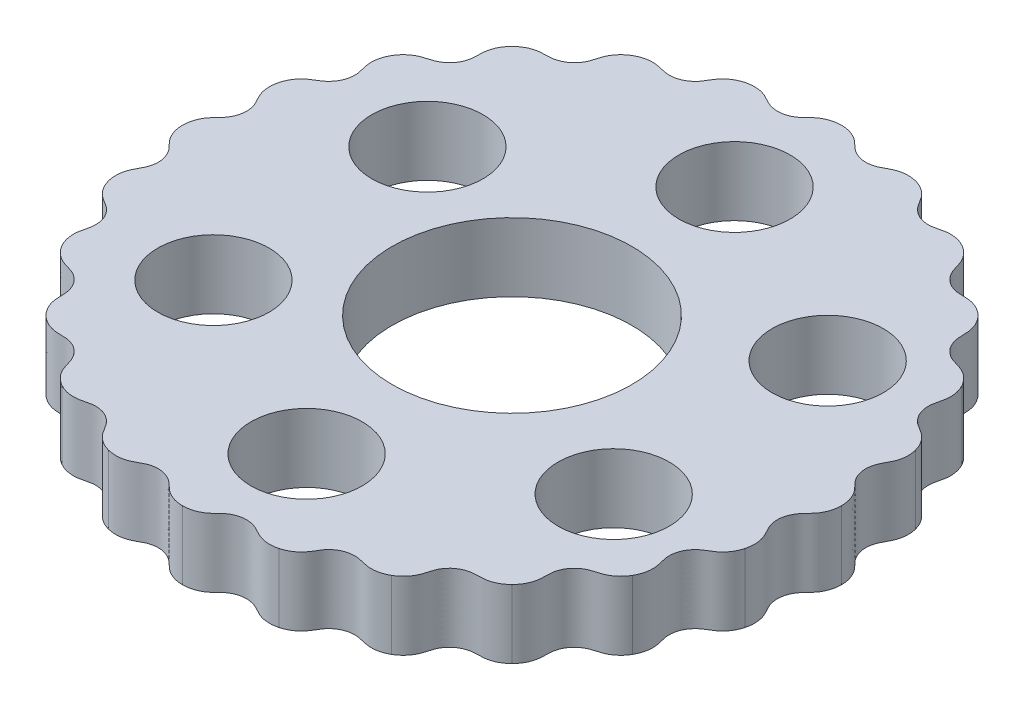
from build123d import *

# Parameters (mm, degrees)
SKETCH1_R           = 14
SKETCH1_R_2         = 6.5
BOSS_EXTRUDE1_DEPTH = 8


with BuildPart() as part:
    # Sketch1 → Boss-Extrude1 (new body)
    with BuildSketch(Plane(origin=(0, 0, 0), x_dir=(1, 0, 0), z_dir=(0, 1, 0))):
        with BuildLine():
            add(Edge.make_bspline(
                [(-38.188097082, 9.9647088), (-38.113372009, 10.244100974), (-37.951839108, 10.654037682), (-37.652977987, 11.14456219), (-37.390260931, 11.479949616), (-37.145465578, 11.725596787), (-36.927714992, 11.908277882), (-36.752948947, 12.0384598), (-36.590559186, 12.146195792), (-36.458882173, 12.226744009), (-36.305001509, 12.317396194), (-36.107721818, 12.43804004), (-35.856239089, 12.594685167), (-35.413957853, 12.936912027), (-35.008192839, 13.424260923), (-34.730315468, 13.922699482), (-34.557012484, 14.436902449), (-34.457602125, 15.223415448), (-34.576890778, 15.867285655), (-34.632823051, 16.071325063), (-34.673334751, 16.238891625), (-34.711262719, 16.392459936), (-34.752702236, 16.572074341), (-34.794830164, 16.780749484), (-34.825838307, 16.988053197), (-34.8500137, 17.262666694), (-34.849186563, 17.61539272), (-34.797869935, 18.037592245), (-34.662664385, 18.594763053), (-34.486664191, 18.999578144), (-34.341886986, 19.250157358)],
                knots=[-8.4146e-05, -8.4146e-05, -8.4146e-05, -8.4146e-05, 0.124936892, 0.187447412, 0.249957931, 0.31246845, 0.34372371, 0.37497897, 0.406234229, 0.421861859, 0.437489489, 0.453117119, 0.468744749, 0.484372378, 0.492186193, 0.500000008, 0.507813823, 0.515627638, 0.531255268, 0.546882898, 0.562510528, 0.578138157, 0.593765787, 0.625021047, 0.656276307, 0.687531566, 0.750042086, 0.812552605, 0.875063124, 1.000084163, 1.000084163, 1.000084163, 1.000084163], degree=3))
            add(Edge.make_bspline(
                [(-34.341886986, 19.250157358), (-34.197396092, 19.500689201), (-33.935267864, 19.854849864), (-33.519633104, 20.251309204), (-33.179063261, 20.507272404), (-32.879030942, 20.681191651), (-32.62141868, 20.801290039), (-32.418914084, 20.881803336), (-32.234173493, 20.943838749), (-32.086135853, 20.987561834), (-31.914036033, 21.035297874), (-31.69225356, 21.100771139), (-31.408797155, 21.186990194), (-30.893011458, 21.403085149), (-30.374937375, 21.768808321), (-29.977523054, 22.178343042), (-29.677039705, 22.630170855), (-29.377452129, 23.364154779), (-29.326030247, 24.016959816), (-29.32724739, 24.228523087), (-29.323009269, 24.400865157), (-29.31989847, 24.559017234), (-29.31343834, 24.743236764), (-29.300121693, 24.955704984), (-29.27641911, 25.163970492), (-29.228695543, 25.435483813), (-29.136604377, 25.775976912), (-28.977763043, 26.170508616), (-28.702958094, 26.673700518), (-28.428181106, 27.019169667), (-28.223482392, 27.223739503)],
                knots=[-8.4146e-05, -8.4146e-05, -8.4146e-05, -8.4146e-05, 0.124936892, 0.187447412, 0.249957931, 0.31246845, 0.34372371, 0.37497897, 0.406234229, 0.421861859, 0.437489489, 0.453117119, 0.468744749, 0.484372378, 0.492186193, 0.500000008, 0.507813823, 0.515627638, 0.531255268, 0.546882898, 0.562510528, 0.578138157, 0.593765787, 0.625021047, 0.656276307, 0.687531566, 0.750042086, 0.812552605, 0.875063124, 1.000084163, 1.000084163, 1.000084163, 1.000084163], degree=3))
            add(Edge.make_bspline(
                [(-28.223482392, 27.223739503), (-28.019072493, 27.428337686), (-27.674212543, 27.702586839), (-27.170128967, 27.977962964), (-26.774915608, 28.137058467), (-26.440093029, 28.227397481), (-26.160174942, 28.276728657), (-25.943732148, 28.302086483), (-25.749230494, 28.314193708), (-25.594920747, 28.318112004), (-25.41633009, 28.319678767), (-25.185158943, 28.325519557), (-24.889045948, 28.335436852), (-24.334905732, 28.410673388), (-23.739828474, 28.629847406), (-23.249960332, 28.922569175), (-22.842774062, 29.281230515), (-22.363425666, 29.912665573), (-22.144797566, 30.529917856), (-22.091216632, 30.734587303), (-22.042517512, 30.899960052), (-21.998579941, 31.051918094), (-21.944660412, 31.228188491), (-21.876806697, 31.42997043), (-21.800008679, 31.625004783), (-21.683638435, 31.874914744), (-21.506559101, 32.179970874), (-21.251017835, 32.519948074), (-20.85534099, 32.934869374), (-20.500512806, 33.197449429), (-20.249842461, 33.342068792)],
                knots=[-8.4146e-05, -8.4146e-05, -8.4146e-05, -8.4146e-05, 0.124936892, 0.187447412, 0.249957931, 0.31246845, 0.34372371, 0.37497897, 0.406234229, 0.421861859, 0.437489489, 0.453117119, 0.468744749, 0.484372378, 0.492186193, 0.500000008, 0.507813823, 0.515627638, 0.531255268, 0.546882898, 0.562510528, 0.578138157, 0.593765787, 0.625021047, 0.656276307, 0.687531566, 0.750042086, 0.812552605, 0.875063124, 1.000084163, 1.000084163, 1.000084163, 1.000084163], degree=3))
            add(Edge.make_bspline(
                [(-20.249842461, 33.342068792), (-19.999443754, 33.486790286), (-19.595353719, 33.662438303), (-19.037173788, 33.797964783), (-18.614250052, 33.849350495), (-18.267454818, 33.849952821), (-17.984306861, 33.825154945), (-17.768676088, 33.793629208), (-17.577668336, 33.754983156), (-17.427602437, 33.718829639), (-17.254691601, 33.674120352), (-17.029885713, 33.619930626), (-16.741295738, 33.552870315), (-16.186564743, 33.482121187), (-15.555037841, 33.539809704), (-15.006099582, 33.695770015), (-14.519959463, 33.936822705), (-13.893517049, 34.422677641), (-13.522581874, 34.962312446), (-13.417854315, 35.146140185), (-13.328012961, 35.293273735), (-13.24624289, 35.428682052), (-13.148538489, 35.584990779), (-13.030771824, 35.762335332), (-12.906112031, 35.930847261), (-12.729025549, 36.142122911), (-12.479025711, 36.390953001), (-12.144199228, 36.653206813), (-11.65461521, 36.951581309), (-11.243916784, 37.113377874), (-10.964357579, 37.188191192)],
                knots=[-8.4146e-05, -8.4146e-05, -8.4146e-05, -8.4146e-05, 0.124936892, 0.187447412, 0.249957931, 0.31246845, 0.34372371, 0.37497897, 0.406234229, 0.421861859, 0.437489489, 0.453117119, 0.468744749, 0.484372378, 0.492186193, 0.500000008, 0.507813823, 0.515627638, 0.531255268, 0.546882898, 0.562510528, 0.578138157, 0.593765787, 0.625021047, 0.656276307, 0.687531566, 0.750042086, 0.812552605, 0.875063124, 1.000084163, 1.000084163, 1.000084163, 1.000084163], degree=3))
            add(Edge.make_bspline(
                [(-10.964357579, 37.188191192), (-10.685034322, 37.263173466), (-10.249252269, 37.328250225), (-9.675015023, 37.314691156), (-9.253202464, 37.254865224), (-8.918068097, 37.165689816), (-8.650986335, 37.068452823), (-8.450862464, 36.982191949), (-8.276365478, 36.895426285), (-8.140770169, 36.821664756), (-7.985322742, 36.733726284), (-7.782202261, 36.623198983), (-7.520802237, 36.483731115), (-7.003284465, 36.271817759), (-6.378345433, 36.164089397), (-5.807746293, 36.172659814), (-5.275781969, 36.279676511), (-4.544936552, 36.586841114), (-4.046972922, 37.012083221), (-3.898235749, 37.162541695), (-3.773374699, 37.281409137), (-3.659344625, 37.391039876), (-3.524513745, 37.516734753), (-3.364859734, 37.657556181), (-3.200833523, 37.788061877), (-2.975098956, 37.946305129), (-2.669215688, 38.121951821), (-2.27792186, 38.28861008), (-1.727795011, 38.450104043), (-1.289214762, 38.500090949), (-0.999818195, 38.499999819)],
                knots=[-8.4146e-05, -8.4146e-05, -8.4146e-05, -8.4146e-05, 0.124936892, 0.187447412, 0.249957931, 0.31246845, 0.34372371, 0.37497897, 0.406234229, 0.421861859, 0.437489489, 0.453117119, 0.468744749, 0.484372378, 0.492186193, 0.500000008, 0.507813823, 0.515627638, 0.531255268, 0.546882898, 0.562510528, 0.578138157, 0.593765787, 0.625021047, 0.656276307, 0.687531566, 0.750042086, 0.812552605, 0.875063124, 1.000084163, 1.000084163, 1.000084163, 1.000084163], degree=3))
            add(Edge.make_bspline(
                [(-0.999818195, 38.499999819), (-0.710605806, 38.500132956), (-0.272829562, 38.450203583), (0.278331679, 38.288482992), (0.670287233, 38.121522456), (0.970921879, 37.948646469), (1.203736266, 37.7855969), (1.374715124, 37.650479424), (1.520809663, 37.521507086), (1.632693786, 37.415164271), (1.760084318, 37.289989475), (1.927677066, 37.130656852), (2.14407316, 36.928285931), (2.58910973, 36.589649892), (3.164872328, 36.323846162), (3.718246961, 36.184442624), (4.259782999, 36.150130318), (5.045225512, 36.257671828), (5.636282199, 36.53954169), (5.818892795, 36.646377402), (5.970264465, 36.728878117), (6.108783582, 36.805260125), (6.271552439, 36.891775253), (6.462213639, 36.986476808), (6.654428151, 37.070082523), (6.913427368, 37.164509362), (7.254348625, 37.255002623), (7.67544377, 37.314707844), (8.248623215, 37.328315728), (8.685196768, 37.263086451), (8.9647088, 37.188097082)],
                knots=[-8.4146e-05, -8.4146e-05, -8.4146e-05, -8.4146e-05, 0.124936892, 0.187447412, 0.249957931, 0.31246845, 0.34372371, 0.37497897, 0.406234229, 0.421861859, 0.437489489, 0.453117119, 0.468744749, 0.484372378, 0.492186193, 0.500000008, 0.507813823, 0.515627638, 0.531255268, 0.546882898, 0.562510528, 0.578138157, 0.593765787, 0.625021047, 0.656276307, 0.687531566, 0.750042086, 0.812552605, 0.875063124, 1.000084163, 1.000084163, 1.000084163, 1.000084163], degree=3))
            add(Edge.make_bspline(
                [(8.9647088, 37.188097082), (9.244100974, 37.113372009), (9.654037682, 36.951839108), (10.14456219, 36.652977987), (10.479949616, 36.390260931), (10.725596787, 36.145465578), (10.908277882, 35.927714992), (11.0384598, 35.752948947), (11.146195792, 35.590559186), (11.226744009, 35.458882173), (11.317396194, 35.305001509), (11.43804004, 35.107721818), (11.594685167, 34.856239089), (11.936912027, 34.413957853), (12.424260923, 34.008192839), (12.922699482, 33.730315468), (13.436902449, 33.557012484), (14.223415448, 33.457602125), (14.867285655, 33.576890778), (15.071325063, 33.632823051), (15.238891625, 33.673334751), (15.392459936, 33.711262719), (15.572074341, 33.752702236), (15.780749484, 33.794830164), (15.988053197, 33.825838307), (16.262666694, 33.8500137), (16.61539272, 33.849186563), (17.037592245, 33.797869935), (17.594763053, 33.662664385), (17.999578144, 33.486664191), (18.250157358, 33.341886986)],
                knots=[-8.4146e-05, -8.4146e-05, -8.4146e-05, -8.4146e-05, 0.124936892, 0.187447412, 0.249957931, 0.31246845, 0.34372371, 0.37497897, 0.406234229, 0.421861859, 0.437489489, 0.453117119, 0.468744749, 0.484372378, 0.492186193, 0.500000008, 0.507813823, 0.515627638, 0.531255268, 0.546882898, 0.562510528, 0.578138157, 0.593765787, 0.625021047, 0.656276307, 0.687531566, 0.750042086, 0.812552605, 0.875063124, 1.000084163, 1.000084163, 1.000084163, 1.000084163], degree=3))
            add(Edge.make_bspline(
                [(18.250157358, 33.341886986), (18.500689201, 33.197396092), (18.854849864, 32.935267864), (19.251309204, 32.519633104), (19.507272404, 32.179063261), (19.681191651, 31.879030942), (19.801290039, 31.62141868), (19.881803336, 31.418914084), (19.943838749, 31.234173493), (19.987561834, 31.086135853), (20.035297874, 30.914036033), (20.100771139, 30.69225356), (20.186990194, 30.408797155), (20.403085149, 29.893011458), (20.768808321, 29.374937375), (21.178343042, 28.977523054), (21.630170855, 28.677039705), (22.364154779, 28.377452129), (23.016959816, 28.326030247), (23.228523087, 28.32724739), (23.400865157, 28.323009269), (23.559017234, 28.31989847), (23.743236764, 28.31343834), (23.955704984, 28.300121693), (24.163970492, 28.27641911), (24.435483813, 28.228695543), (24.775976912, 28.136604377), (25.170508616, 27.977763043), (25.673700518, 27.702958094), (26.019169667, 27.428181106), (26.223739503, 27.223482392)],
                knots=[-8.4146e-05, -8.4146e-05, -8.4146e-05, -8.4146e-05, 0.124936892, 0.187447412, 0.249957931, 0.31246845, 0.34372371, 0.37497897, 0.406234229, 0.421861859, 0.437489489, 0.453117119, 0.468744749, 0.484372378, 0.492186193, 0.500000008, 0.507813823, 0.515627638, 0.531255268, 0.546882898, 0.562510528, 0.578138157, 0.593765787, 0.625021047, 0.656276307, 0.687531566, 0.750042086, 0.812552605, 0.875063124, 1.000084163, 1.000084163, 1.000084163, 1.000084163], degree=3))
            add(Edge.make_bspline(
                [(26.223739503, 27.223482392), (26.428337686, 27.019072493), (26.702586839, 26.674212543), (26.977962964, 26.170128967), (27.137058467, 25.774915608), (27.227397481, 25.440093029), (27.276728657, 25.160174942), (27.302086483, 24.943732148), (27.314193708, 24.749230494), (27.318112004, 24.594920747), (27.319678767, 24.41633009), (27.325519557, 24.185158943), (27.335436852, 23.889045948), (27.410673388, 23.334905732), (27.629847406, 22.739828474), (27.922569175, 22.249960332), (28.281230515, 21.842774062), (28.912665573, 21.363425666), (29.529917856, 21.144797566), (29.734587303, 21.091216632), (29.899960052, 21.042517512), (30.051918094, 20.998579941), (30.228188491, 20.944660412), (30.42997043, 20.876806697), (30.625004783, 20.800008679), (30.874914744, 20.683638435), (31.179970874, 20.506559101), (31.519948074, 20.251017835), (31.934869374, 19.85534099), (32.197449429, 19.500512806), (32.342068792, 19.249842461)],
                knots=[-8.4146e-05, -8.4146e-05, -8.4146e-05, -8.4146e-05, 0.124936892, 0.187447412, 0.249957931, 0.31246845, 0.34372371, 0.37497897, 0.406234229, 0.421861859, 0.437489489, 0.453117119, 0.468744749, 0.484372378, 0.492186193, 0.500000008, 0.507813823, 0.515627638, 0.531255268, 0.546882898, 0.562510528, 0.578138157, 0.593765787, 0.625021047, 0.656276307, 0.687531566, 0.750042086, 0.812552605, 0.875063124, 1.000084163, 1.000084163, 1.000084163, 1.000084163], degree=3))
            add(Edge.make_bspline(
                [(32.342068792, 19.249842461), (32.486790286, 18.999443754), (32.662438303, 18.595353719), (32.797964783, 18.037173788), (32.849350495, 17.614250052), (32.849952821, 17.267454818), (32.825154945, 16.984306861), (32.793629208, 16.768676088), (32.754983156, 16.577668336), (32.718829639, 16.427602437), (32.674120352, 16.254691601), (32.619930626, 16.029885713), (32.552870315, 15.741295738), (32.482121187, 15.186564743), (32.539809704, 14.555037841), (32.695770015, 14.006099582), (32.936822705, 13.519959463), (33.422677641, 12.893517049), (33.962312446, 12.522581874), (34.146140185, 12.417854315), (34.293273735, 12.328012961), (34.428682052, 12.24624289), (34.584990779, 12.148538489), (34.762335332, 12.030771824), (34.930847261, 11.906112031), (35.142122911, 11.729025549), (35.390953001, 11.479025711), (35.653206813, 11.144199228), (35.951581309, 10.65461521), (36.113377874, 10.243916784), (36.188191192, 9.964357579)],
                knots=[-8.4146e-05, -8.4146e-05, -8.4146e-05, -8.4146e-05, 0.124936892, 0.187447412, 0.249957931, 0.31246845, 0.34372371, 0.37497897, 0.406234229, 0.421861859, 0.437489489, 0.453117119, 0.468744749, 0.484372378, 0.492186193, 0.500000008, 0.507813823, 0.515627638, 0.531255268, 0.546882898, 0.562510528, 0.578138157, 0.593765787, 0.625021047, 0.656276307, 0.687531566, 0.750042086, 0.812552605, 0.875063124, 1.000084163, 1.000084163, 1.000084163, 1.000084163], degree=3))
            add(Edge.make_bspline(
                [(36.188191192, 9.964357579), (36.263173466, 9.685034322), (36.328250225, 9.249252269), (36.314691156, 8.675015023), (36.254865224, 8.253202464), (36.165689816, 7.918068097), (36.068452823, 7.650986335), (35.982191949, 7.450862464), (35.895426285, 7.276365478), (35.821664756, 7.140770169), (35.733726284, 6.985322742), (35.623198983, 6.782202261), (35.483731115, 6.520802237), (35.271817759, 6.003284465), (35.164089397, 5.378345433), (35.172659814, 4.807746293), (35.279676511, 4.275781969), (35.586841114, 3.544936552), (36.012083221, 3.046972922), (36.162541695, 2.898235749), (36.281409137, 2.773374699), (36.391039876, 2.659344625), (36.516734753, 2.524513745), (36.657556181, 2.364859734), (36.788061877, 2.200833523), (36.946305129, 1.975098956), (37.121951821, 1.669215688), (37.28861008, 1.27792186), (37.450104043, 0.727795011), (37.500090949, 0.289214762), (37.499999819, -0.000181805)],
                knots=[-8.4146e-05, -8.4146e-05, -8.4146e-05, -8.4146e-05, 0.124936892, 0.187447412, 0.249957931, 0.31246845, 0.34372371, 0.37497897, 0.406234229, 0.421861859, 0.437489489, 0.453117119, 0.468744749, 0.484372378, 0.492186193, 0.500000008, 0.507813823, 0.515627638, 0.531255268, 0.546882898, 0.562510528, 0.578138157, 0.593765787, 0.625021047, 0.656276307, 0.687531566, 0.750042086, 0.812552605, 0.875063124, 1.000084163, 1.000084163, 1.000084163, 1.000084163], degree=3))
            add(Edge.make_bspline(
                [(37.499999819, -0.000181805), (37.500132956, -0.289394194), (37.450203583, -0.727170438), (37.288482992, -1.278331679), (37.121522456, -1.670287233), (36.948646469, -1.970921879), (36.7855969, -2.203736266), (36.650479424, -2.374715124), (36.521507086, -2.520809663), (36.415164271, -2.632693786), (36.289989475, -2.760084318), (36.130656852, -2.927677066), (35.928285931, -3.14407316), (35.589649892, -3.58910973), (35.323846162, -4.164872328), (35.184442624, -4.718246961), (35.150130318, -5.259782999), (35.257671828, -6.045225512), (35.53954169, -6.636282199), (35.646377402, -6.818892795), (35.728878117, -6.970264465), (35.805260125, -7.108783582), (35.891775253, -7.271552439), (35.986476808, -7.462213639), (36.070082523, -7.654428151), (36.164509362, -7.913427368), (36.255002623, -8.254348625), (36.314707844, -8.67544377), (36.328315728, -9.248623215), (36.263086451, -9.685196768), (36.188097082, -9.9647088)],
                knots=[-8.4146e-05, -8.4146e-05, -8.4146e-05, -8.4146e-05, 0.124936892, 0.187447412, 0.249957931, 0.31246845, 0.34372371, 0.37497897, 0.406234229, 0.421861859, 0.437489489, 0.453117119, 0.468744749, 0.484372378, 0.492186193, 0.500000008, 0.507813823, 0.515627638, 0.531255268, 0.546882898, 0.562510528, 0.578138157, 0.593765787, 0.625021047, 0.656276307, 0.687531566, 0.750042086, 0.812552605, 0.875063124, 1.000084163, 1.000084163, 1.000084163, 1.000084163], degree=3))
            add(Edge.make_bspline(
                [(36.188097082, -9.9647088), (36.113372009, -10.244100974), (35.951839108, -10.654037682), (35.652977987, -11.14456219), (35.390260931, -11.479949616), (35.145465578, -11.725596787), (34.927714992, -11.908277882), (34.752948947, -12.0384598), (34.590559186, -12.146195792), (34.458882173, -12.226744009), (34.305001509, -12.317396194), (34.107721818, -12.43804004), (33.856239089, -12.594685167), (33.413957853, -12.936912027), (33.008192839, -13.424260923), (32.730315468, -13.922699482), (32.557012484, -14.436902449), (32.457602125, -15.223415448), (32.576890778, -15.867285655), (32.632823051, -16.071325063), (32.673334751, -16.238891625), (32.711262719, -16.392459936), (32.752702236, -16.572074341), (32.794830164, -16.780749484), (32.825838307, -16.988053197), (32.8500137, -17.262666694), (32.849186563, -17.61539272), (32.797869935, -18.037592245), (32.662664385, -18.594763053), (32.486664191, -18.999578144), (32.341886986, -19.250157358)],
                knots=[-8.4146e-05, -8.4146e-05, -8.4146e-05, -8.4146e-05, 0.124936892, 0.187447412, 0.249957931, 0.31246845, 0.34372371, 0.37497897, 0.406234229, 0.421861859, 0.437489489, 0.453117119, 0.468744749, 0.484372378, 0.492186193, 0.500000008, 0.507813823, 0.515627638, 0.531255268, 0.546882898, 0.562510528, 0.578138157, 0.593765787, 0.625021047, 0.656276307, 0.687531566, 0.750042086, 0.812552605, 0.875063124, 1.000084163, 1.000084163, 1.000084163, 1.000084163], degree=3))
            add(Edge.make_bspline(
                [(32.341886986, -19.250157358), (32.197396092, -19.500689201), (31.935267864, -19.854849864), (31.519633104, -20.251309204), (31.179063261, -20.507272404), (30.879030942, -20.681191651), (30.62141868, -20.801290039), (30.418914084, -20.881803336), (30.234173493, -20.943838749), (30.086135853, -20.987561834), (29.914036033, -21.035297874), (29.69225356, -21.100771139), (29.408797155, -21.186990194), (28.893011458, -21.403085149), (28.374937375, -21.768808321), (27.977523054, -22.178343042), (27.677039705, -22.630170855), (27.377452129, -23.364154779), (27.326030247, -24.016959816), (27.32724739, -24.228523087), (27.323009269, -24.400865157), (27.31989847, -24.559017234), (27.31343834, -24.743236764), (27.300121693, -24.955704984), (27.27641911, -25.163970492), (27.228695543, -25.435483813), (27.136604377, -25.775976912), (26.977763043, -26.170508616), (26.702958094, -26.673700518), (26.428181106, -27.019169667), (26.223482392, -27.223739503)],
                knots=[-8.4146e-05, -8.4146e-05, -8.4146e-05, -8.4146e-05, 0.124936892, 0.187447412, 0.249957931, 0.31246845, 0.34372371, 0.37497897, 0.406234229, 0.421861859, 0.437489489, 0.453117119, 0.468744749, 0.484372378, 0.492186193, 0.500000008, 0.507813823, 0.515627638, 0.531255268, 0.546882898, 0.562510528, 0.578138157, 0.593765787, 0.625021047, 0.656276307, 0.687531566, 0.750042086, 0.812552605, 0.875063124, 1.000084163, 1.000084163, 1.000084163, 1.000084163], degree=3))
            add(Edge.make_bspline(
                [(26.223482392, -27.223739503), (26.019072493, -27.428337686), (25.674212543, -27.702586839), (25.170128967, -27.977962964), (24.774915608, -28.137058467), (24.440093029, -28.227397481), (24.160174942, -28.276728657), (23.943732148, -28.302086483), (23.749230494, -28.314193708), (23.594920747, -28.318112004), (23.41633009, -28.319678767), (23.185158943, -28.325519557), (22.889045948, -28.335436852), (22.334905732, -28.410673388), (21.739828474, -28.629847406), (21.249960332, -28.922569175), (20.842774062, -29.281230515), (20.363425666, -29.912665573), (20.144797566, -30.529917856), (20.091216632, -30.734587303), (20.042517512, -30.899960052), (19.998579941, -31.051918094), (19.944660412, -31.228188491), (19.876806697, -31.42997043), (19.800008679, -31.625004783), (19.683638435, -31.874914744), (19.506559101, -32.179970874), (19.251017835, -32.519948074), (18.85534099, -32.934869374), (18.500512806, -33.197449429), (18.249842461, -33.342068792)],
                knots=[-8.4146e-05, -8.4146e-05, -8.4146e-05, -8.4146e-05, 0.124936892, 0.187447412, 0.249957931, 0.31246845, 0.34372371, 0.37497897, 0.406234229, 0.421861859, 0.437489489, 0.453117119, 0.468744749, 0.484372378, 0.492186193, 0.500000008, 0.507813823, 0.515627638, 0.531255268, 0.546882898, 0.562510528, 0.578138157, 0.593765787, 0.625021047, 0.656276307, 0.687531566, 0.750042086, 0.812552605, 0.875063124, 1.000084163, 1.000084163, 1.000084163, 1.000084163], degree=3))
            add(Edge.make_bspline(
                [(18.249842461, -33.342068792), (17.999443754, -33.486790286), (17.595353719, -33.662438303), (17.037173788, -33.797964783), (16.614250052, -33.849350495), (16.267454818, -33.849952821), (15.984306861, -33.825154945), (15.768676088, -33.793629208), (15.577668336, -33.754983156), (15.427602437, -33.718829639), (15.254691601, -33.674120352), (15.029885713, -33.619930626), (14.741295738, -33.552870315), (14.186564743, -33.482121187), (13.555037841, -33.539809704), (13.006099582, -33.695770015), (12.519959463, -33.936822705), (11.893517049, -34.422677641), (11.522581874, -34.962312446), (11.417854315, -35.146140185), (11.328012961, -35.293273735), (11.24624289, -35.428682052), (11.148538489, -35.584990779), (11.030771824, -35.762335332), (10.906112031, -35.930847261), (10.729025549, -36.142122911), (10.479025711, -36.390953001), (10.144199228, -36.653206813), (9.65461521, -36.951581309), (9.243916784, -37.113377874), (8.964357579, -37.188191192)],
                knots=[-8.4146e-05, -8.4146e-05, -8.4146e-05, -8.4146e-05, 0.124936892, 0.187447412, 0.249957931, 0.31246845, 0.34372371, 0.37497897, 0.406234229, 0.421861859, 0.437489489, 0.453117119, 0.468744749, 0.484372378, 0.492186193, 0.500000008, 0.507813823, 0.515627638, 0.531255268, 0.546882898, 0.562510528, 0.578138157, 0.593765787, 0.625021047, 0.656276307, 0.687531566, 0.750042086, 0.812552605, 0.875063124, 1.000084163, 1.000084163, 1.000084163, 1.000084163], degree=3))
            add(Edge.make_bspline(
                [(8.964357579, -37.188191192), (8.685034322, -37.263173466), (8.249252269, -37.328250225), (7.675015023, -37.314691156), (7.253202464, -37.254865224), (6.918068097, -37.165689816), (6.650986335, -37.068452823), (6.450862464, -36.982191949), (6.276365478, -36.895426285), (6.140770169, -36.821664756), (5.985322742, -36.733726284), (5.782202261, -36.623198983), (5.520802237, -36.483731115), (5.003284465, -36.271817759), (4.378345433, -36.164089397), (3.807746293, -36.172659814), (3.275781969, -36.279676511), (2.544936552, -36.586841114), (2.046972922, -37.012083221), (1.898235749, -37.162541695), (1.773374699, -37.281409137), (1.659344625, -37.391039876), (1.524513745, -37.516734753), (1.364859734, -37.657556181), (1.200833523, -37.788061877), (0.975098956, -37.946305129), (0.669215688, -38.121951821), (0.27792186, -38.28861008), (-0.272204989, -38.450104043), (-0.710785238, -38.500090949), (-1.000181805, -38.499999819)],
                knots=[-8.4146e-05, -8.4146e-05, -8.4146e-05, -8.4146e-05, 0.124936892, 0.187447412, 0.249957931, 0.31246845, 0.34372371, 0.37497897, 0.406234229, 0.421861859, 0.437489489, 0.453117119, 0.468744749, 0.484372378, 0.492186193, 0.500000008, 0.507813823, 0.515627638, 0.531255268, 0.546882898, 0.562510528, 0.578138157, 0.593765787, 0.625021047, 0.656276307, 0.687531566, 0.750042086, 0.812552605, 0.875063124, 1.000084163, 1.000084163, 1.000084163, 1.000084163], degree=3))
            add(Edge.make_bspline(
                [(-1.000181805, -38.499999819), (-1.289394194, -38.500132956), (-1.727170438, -38.450203583), (-2.278331679, -38.288482992), (-2.670287233, -38.121522456), (-2.970921879, -37.948646469), (-3.203736266, -37.7855969), (-3.374715124, -37.650479424), (-3.520809663, -37.521507086), (-3.632693786, -37.415164271), (-3.760084318, -37.289989475), (-3.927677066, -37.130656852), (-4.14407316, -36.928285931), (-4.58910973, -36.589649892), (-5.164872328, -36.323846162), (-5.718246961, -36.184442624), (-6.259782999, -36.150130318), (-7.045225512, -36.257671828), (-7.636282199, -36.53954169), (-7.818892795, -36.646377402), (-7.970264465, -36.728878117), (-8.108783582, -36.805260125), (-8.271552439, -36.891775253), (-8.462213639, -36.986476808), (-8.654428151, -37.070082523), (-8.913427368, -37.164509362), (-9.254348625, -37.255002623), (-9.67544377, -37.314707844), (-10.248623215, -37.328315728), (-10.685196768, -37.263086451), (-10.9647088, -37.188097082)],
                knots=[-8.4146e-05, -8.4146e-05, -8.4146e-05, -8.4146e-05, 0.124936892, 0.187447412, 0.249957931, 0.31246845, 0.34372371, 0.37497897, 0.406234229, 0.421861859, 0.437489489, 0.453117119, 0.468744749, 0.484372378, 0.492186193, 0.500000008, 0.507813823, 0.515627638, 0.531255268, 0.546882898, 0.562510528, 0.578138157, 0.593765787, 0.625021047, 0.656276307, 0.687531566, 0.750042086, 0.812552605, 0.875063124, 1.000084163, 1.000084163, 1.000084163, 1.000084163], degree=3))
            add(Edge.make_bspline(
                [(-10.9647088, -37.188097082), (-11.244100974, -37.113372009), (-11.654037682, -36.951839108), (-12.14456219, -36.652977987), (-12.479949616, -36.390260931), (-12.725596787, -36.145465578), (-12.908277882, -35.927714992), (-13.0384598, -35.752948947), (-13.146195792, -35.590559186), (-13.226744009, -35.458882173), (-13.317396194, -35.305001509), (-13.43804004, -35.107721818), (-13.594685167, -34.856239089), (-13.936912027, -34.413957853), (-14.424260923, -34.008192839), (-14.922699482, -33.730315468), (-15.436902449, -33.557012484), (-16.223415448, -33.457602125), (-16.867285655, -33.576890778), (-17.071325063, -33.632823051), (-17.238891625, -33.673334751), (-17.392459936, -33.711262719), (-17.572074341, -33.752702236), (-17.780749484, -33.794830164), (-17.988053197, -33.825838307), (-18.262666694, -33.8500137), (-18.61539272, -33.849186563), (-19.037592245, -33.797869935), (-19.594763053, -33.662664385), (-19.999578144, -33.486664191), (-20.250157358, -33.341886986)],
                knots=[-8.4146e-05, -8.4146e-05, -8.4146e-05, -8.4146e-05, 0.124936892, 0.187447412, 0.249957931, 0.31246845, 0.34372371, 0.37497897, 0.406234229, 0.421861859, 0.437489489, 0.453117119, 0.468744749, 0.484372378, 0.492186193, 0.500000008, 0.507813823, 0.515627638, 0.531255268, 0.546882898, 0.562510528, 0.578138157, 0.593765787, 0.625021047, 0.656276307, 0.687531566, 0.750042086, 0.812552605, 0.875063124, 1.000084163, 1.000084163, 1.000084163, 1.000084163], degree=3))
            add(Edge.make_bspline(
                [(-20.250157358, -33.341886986), (-20.500689201, -33.197396092), (-20.854849864, -32.935267864), (-21.251309205, -32.519633104), (-21.507272404, -32.179063261), (-21.681191651, -31.879030942), (-21.801290039, -31.62141868), (-21.881803336, -31.418914084), (-21.943838749, -31.234173493), (-21.987561834, -31.086135853), (-22.035297874, -30.914036033), (-22.100771139, -30.69225356), (-22.186990194, -30.408797155), (-22.403085149, -29.893011458), (-22.768808321, -29.374937375), (-23.178343042, -28.977523054), (-23.630170855, -28.677039705), (-24.364154779, -28.377452129), (-25.016959816, -28.326030247), (-25.228523087, -28.32724739), (-25.400865157, -28.323009269), (-25.559017234, -28.31989847), (-25.743236764, -28.31343834), (-25.955704984, -28.300121693), (-26.163970492, -28.27641911), (-26.435483813, -28.228695543), (-26.775976912, -28.136604377), (-27.170508616, -27.977763043), (-27.673700518, -27.702958094), (-28.019169667, -27.428181106), (-28.223739503, -27.223482392)],
                knots=[-8.4146e-05, -8.4146e-05, -8.4146e-05, -8.4146e-05, 0.124936892, 0.187447412, 0.249957931, 0.31246845, 0.34372371, 0.37497897, 0.406234229, 0.421861859, 0.437489489, 0.453117119, 0.468744749, 0.484372378, 0.492186193, 0.500000008, 0.507813823, 0.515627638, 0.531255268, 0.546882898, 0.562510528, 0.578138157, 0.593765787, 0.625021047, 0.656276307, 0.687531566, 0.750042086, 0.812552605, 0.875063124, 1.000084163, 1.000084163, 1.000084163, 1.000084163], degree=3))
            add(Edge.make_bspline(
                [(-28.223739503, -27.223482392), (-28.428337686, -27.019072493), (-28.702586839, -26.674212543), (-28.977962964, -26.170128967), (-29.137058467, -25.774915608), (-29.227397481, -25.440093029), (-29.276728657, -25.160174942), (-29.302086483, -24.943732148), (-29.314193708, -24.749230494), (-29.318112004, -24.594920747), (-29.319678767, -24.41633009), (-29.325519557, -24.185158943), (-29.335436852, -23.889045948), (-29.410673388, -23.334905732), (-29.629847406, -22.739828474), (-29.922569175, -22.249960332), (-30.281230515, -21.842774062), (-30.912665573, -21.363425666), (-31.529917856, -21.144797566), (-31.734587303, -21.091216632), (-31.899960052, -21.042517512), (-32.051918094, -20.998579941), (-32.228188491, -20.944660412), (-32.42997043, -20.876806697), (-32.625004783, -20.800008679), (-32.874914744, -20.683638435), (-33.179970874, -20.506559101), (-33.519948074, -20.251017835), (-33.934869374, -19.85534099), (-34.197449429, -19.500512806), (-34.342068792, -19.249842461)],
                knots=[-8.4146e-05, -8.4146e-05, -8.4146e-05, -8.4146e-05, 0.124936892, 0.187447412, 0.249957931, 0.31246845, 0.34372371, 0.37497897, 0.406234229, 0.421861859, 0.437489489, 0.453117119, 0.468744749, 0.484372378, 0.492186193, 0.500000008, 0.507813823, 0.515627638, 0.531255268, 0.546882898, 0.562510528, 0.578138157, 0.593765787, 0.625021047, 0.656276307, 0.687531566, 0.750042086, 0.812552605, 0.875063124, 1.000084163, 1.000084163, 1.000084163, 1.000084163], degree=3))
            add(Edge.make_bspline(
                [(-34.342068792, -19.249842461), (-34.486790286, -18.999443754), (-34.662438303, -18.595353719), (-34.797964783, -18.037173788), (-34.849350495, -17.614250052), (-34.849952821, -17.267454818), (-34.825154945, -16.984306861), (-34.793629208, -16.768676088), (-34.754983156, -16.577668336), (-34.718829639, -16.427602437), (-34.674120352, -16.254691601), (-34.619930626, -16.029885713), (-34.552870315, -15.741295738), (-34.482121187, -15.186564743), (-34.539809704, -14.555037841), (-34.695770015, -14.006099582), (-34.936822705, -13.519959463), (-35.422677641, -12.893517049), (-35.962312446, -12.522581874), (-36.146140185, -12.417854315), (-36.293273735, -12.328012961), (-36.428682052, -12.24624289), (-36.584990779, -12.148538489), (-36.762335332, -12.030771824), (-36.930847261, -11.906112031), (-37.142122911, -11.729025549), (-37.390953001, -11.479025711), (-37.653206813, -11.144199228), (-37.951581309, -10.65461521), (-38.113377874, -10.243916784), (-38.188191192, -9.964357579)],
                knots=[-8.4146e-05, -8.4146e-05, -8.4146e-05, -8.4146e-05, 0.124936892, 0.187447412, 0.249957931, 0.31246845, 0.34372371, 0.37497897, 0.406234229, 0.421861859, 0.437489489, 0.453117119, 0.468744749, 0.484372378, 0.492186193, 0.500000008, 0.507813823, 0.515627638, 0.531255268, 0.546882898, 0.562510528, 0.578138157, 0.593765787, 0.625021047, 0.656276307, 0.687531566, 0.750042086, 0.812552605, 0.875063124, 1.000084163, 1.000084163, 1.000084163, 1.000084163], degree=3))
            add(Edge.make_bspline(
                [(-38.188191192, -9.964357579), (-38.263173466, -9.685034322), (-38.328250225, -9.249252269), (-38.314691156, -8.675015023), (-38.254865224, -8.253202464), (-38.165689816, -7.918068097), (-38.068452823, -7.650986335), (-37.982191949, -7.450862464), (-37.895426285, -7.276365478), (-37.821664756, -7.140770169), (-37.733726284, -6.985322742), (-37.623198983, -6.782202261), (-37.483731115, -6.520802237), (-37.271817759, -6.003284465), (-37.164089397, -5.378345433), (-37.172659814, -4.807746293), (-37.279676511, -4.275781969), (-37.586841114, -3.544936552), (-38.012083221, -3.046972922), (-38.162541695, -2.898235749), (-38.281409137, -2.773374699), (-38.391039876, -2.659344625), (-38.516734753, -2.524513745), (-38.657556181, -2.364859734), (-38.788061877, -2.200833523), (-38.946305129, -1.975098956), (-39.121951821, -1.669215688), (-39.28861008, -1.27792186), (-39.450104043, -0.727795011), (-39.500090949, -0.289214762), (-39.499999819, 0.000181805)],
                knots=[-8.4146e-05, -8.4146e-05, -8.4146e-05, -8.4146e-05, 0.124936892, 0.187447412, 0.249957931, 0.31246845, 0.34372371, 0.37497897, 0.406234229, 0.421861859, 0.437489489, 0.453117119, 0.468744749, 0.484372378, 0.492186193, 0.500000008, 0.507813823, 0.515627638, 0.531255268, 0.546882898, 0.562510528, 0.578138157, 0.593765787, 0.625021047, 0.656276307, 0.687531566, 0.750042086, 0.812552605, 0.875063124, 1.000084163, 1.000084163, 1.000084163, 1.000084163], degree=3))
            add(Edge.make_bspline(
                [(-39.499999819, 0.000181805), (-39.500132956, 0.289394194), (-39.450203583, 0.727170438), (-39.288482992, 1.278331679), (-39.121522456, 1.670287233), (-38.948646469, 1.970921879), (-38.7855969, 2.203736266), (-38.650479424, 2.374715124), (-38.521507086, 2.520809663), (-38.415164271, 2.632693786), (-38.289989475, 2.760084318), (-38.130656852, 2.927677066), (-37.928285931, 3.14407316), (-37.589649892, 3.58910973), (-37.323846162, 4.164872328), (-37.184442624, 4.718246961), (-37.150130318, 5.259782999), (-37.257671828, 6.045225512), (-37.53954169, 6.636282199), (-37.646377402, 6.818892795), (-37.728878117, 6.970264465), (-37.805260125, 7.108783582), (-37.891775253, 7.271552439), (-37.986476808, 7.462213639), (-38.070082523, 7.654428151), (-38.164509362, 7.913427368), (-38.255002623, 8.254348625), (-38.314707844, 8.67544377), (-38.328315728, 9.248623215), (-38.263086451, 9.685196768), (-38.188097082, 9.9647088)],
                knots=[-8.4146e-05, -8.4146e-05, -8.4146e-05, -8.4146e-05, 0.124936892, 0.187447412, 0.249957931, 0.31246845, 0.34372371, 0.37497897, 0.406234229, 0.421861859, 0.437489489, 0.453117119, 0.468744749, 0.484372378, 0.492186193, 0.500000008, 0.507813823, 0.515627638, 0.531255268, 0.546882898, 0.562510528, 0.578138157, 0.593765787, 0.625021047, 0.656276307, 0.687531566, 0.750042086, 0.812552605, 0.875063124, 1.000084163, 1.000084163, 1.000084163, 1.000084163], degree=3))
        make_face()
        with Locations(Location((-1, 0, 0), (0, 0, 270))):
            Circle(SKETCH1_R, mode=Mode.SUBTRACT)
        with Locations(Location((-1, 26, 0), (0, 0, 270))):
            Circle(SKETCH1_R_2, mode=Mode.SUBTRACT)
        with Locations(Location((22.016660498, 13.866025404, 0), (0, 0, 270))):
            Circle(SKETCH1_R_2, mode=Mode.SUBTRACT)
        with Locations(Location((23.016660498, -12.133974596, 0), (0, 0, 270))):
            Circle(SKETCH1_R_2, mode=Mode.SUBTRACT)
        with Locations(Location((1, -26, 0), (0, 0, 270))):
            Circle(SKETCH1_R_2, mode=Mode.SUBTRACT)
        with Locations(Location((-22.016660498, -13.866025404, 0), (0, 0, 270))):
            Circle(SKETCH1_R_2, mode=Mode.SUBTRACT)
        with Locations(Location((-23.016660498, 12.133974596, 0), (0, 0, 270))):
            Circle(SKETCH1_R_2, mode=Mode.SUBTRACT)
    extrude(amount=BOSS_EXTRUDE1_DEPTH)


solid = part.part
